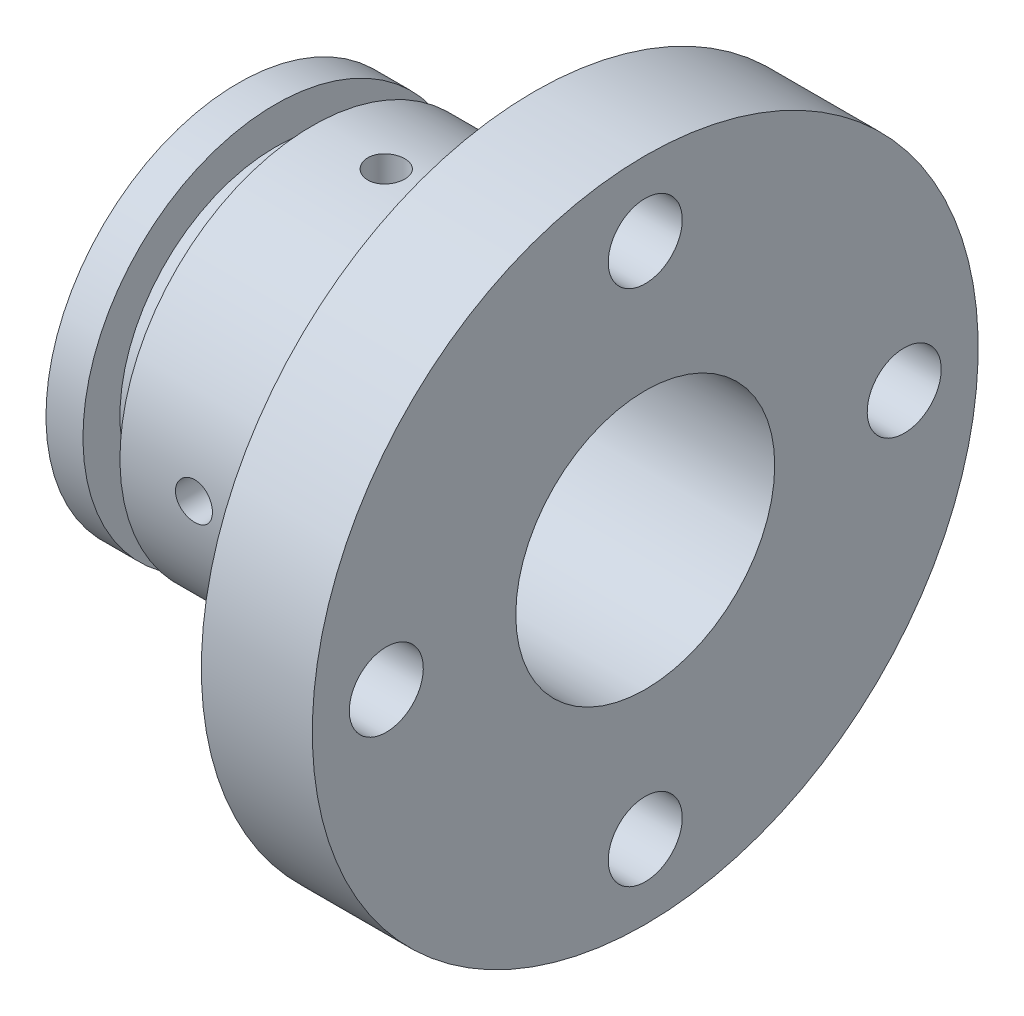
from build123d import *

# Parameters (mm, degrees)
SKETCH2_R          = 17.5
CUT_EXTRUDE1_DEPTH = 85.113019206
SKETCH3_R          = 5
CUT_EXTRUDE2_DEPTH = 85.113019206
SKETCH4_R          = 2.5
CUT_EXTRUDE3_DEPTH = 5
SKETCH5_R          = 2.5
CUT_EXTRUDE4_DEPTH = 5
CUT_EXTRUDE5_START = -5
SKETCH6_R          = 2.5
CUT_EXTRUDE5_DEPTH = 5
CUT_EXTRUDE6_START = -5
SKETCH8_R          = 2.5
CUT_EXTRUDE6_DEPTH = 5


with BuildPart() as part:
    # Sketch1 → Revolve1 (revolve)
    with BuildSketch(Plane.XY):
        Polygon((0, 0), (0, 26), (5, 26), (5, 21), (10, 21), (10, 26), (30, 26), (30, 21), (35, 21), (35, 26), (40, 26), (40, 45), (55, 45), (55, 0), align=None)
    revolve(axis=Axis((0, 0, 0), (1, 0, 0)))

    # Sketch2 → Cut-Extrude1 (cut, through all)
    with BuildSketch(Plane.ZY):
        Circle(SKETCH2_R)
    extrude(amount=-CUT_EXTRUDE1_DEPTH, mode=Mode.SUBTRACT)

    # Sketch3 → Cut-Extrude2 (cut, through all)
    with BuildSketch(Plane(origin=(55, 0, 0), x_dir=(0, 0, -1), z_dir=(1, 0, 0))):
        with Locations((-35, 0)):
            Circle(SKETCH3_R)
        with Locations((0, 35)):
            Circle(SKETCH3_R)
        with Locations((35, 0)):
            Circle(SKETCH3_R)
        with Locations((0, -35)):
            Circle(SKETCH3_R)
    extrude(amount=-CUT_EXTRUDE2_DEPTH, mode=Mode.SUBTRACT)

    # Sketch4 → Cut-Extrude3 (cut)
    with BuildSketch(Plane(origin=(0, 26, 0), x_dir=(1, 0, 0), z_dir=(0, 1, 0))):
        with Locations((20, 0)):
            Circle(SKETCH4_R)
    extrude(amount=-CUT_EXTRUDE3_DEPTH, mode=Mode.SUBTRACT)

    # Sketch5 → Cut-Extrude4 (cut)
    with BuildSketch(Plane.XY.offset(26)):
        with Locations((20, 0)):
            Circle(SKETCH5_R)
    extrude(amount=-CUT_EXTRUDE4_DEPTH, mode=Mode.SUBTRACT)

    # Sketch6 → Cut-Extrude5 (cut)
    with BuildSketch(Plane(origin=(0, -26, 0), x_dir=(-1, 0, 0), z_dir=(0, -1, 0)).offset(CUT_EXTRUDE5_START)):
        with Locations((-20, 0)):
            Circle(SKETCH6_R)
    extrude(amount=CUT_EXTRUDE5_DEPTH, mode=Mode.SUBTRACT)

    # Sketch8 → Cut-Extrude6 (cut)
    with BuildSketch(Plane(origin=(0, 0, -26), x_dir=(-1, 0, 0), z_dir=(0, 0, -1)).offset(CUT_EXTRUDE6_START)):
        with Locations((-20, 0)):
            Circle(SKETCH8_R)
    extrude(amount=CUT_EXTRUDE6_DEPTH, mode=Mode.SUBTRACT)


solid = part.part
